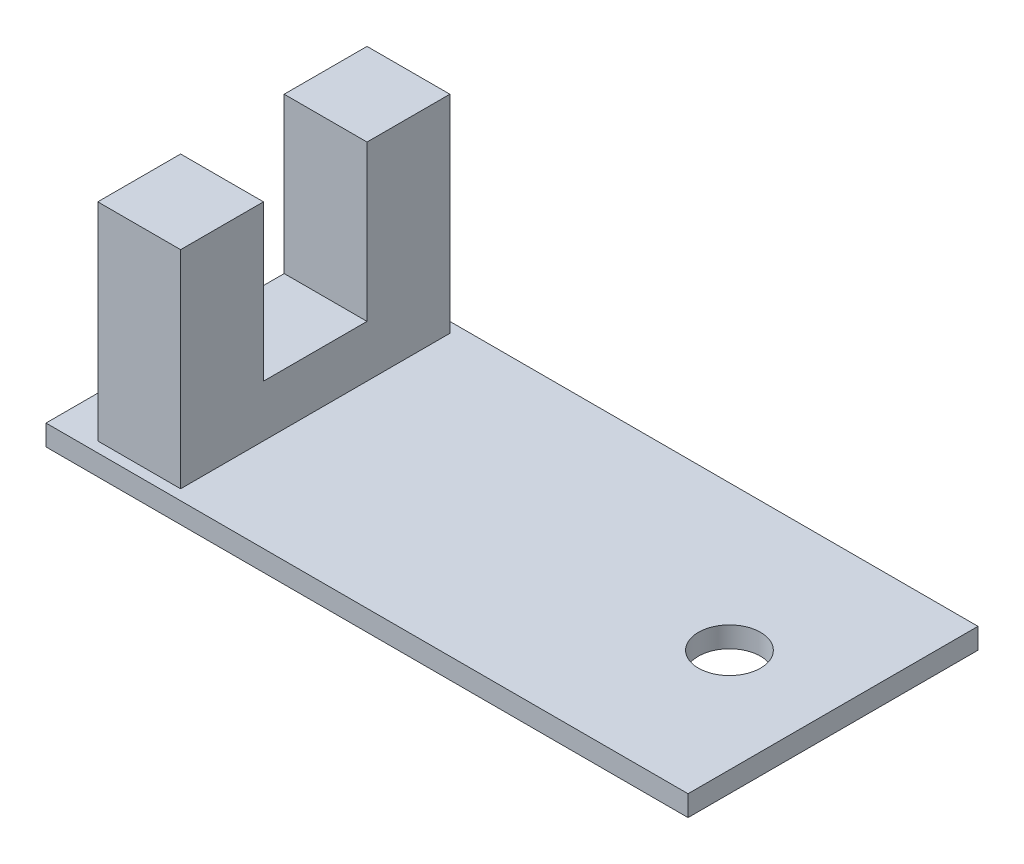
from build123d import *

# Parameters (mm, degrees)
SKETCH1_W           = 31
SKETCH1_H           = 14
BOSS_EXTRUDE1_DEPTH = 1
SKETCH2_W           = 4
SKETCH2_H           = 4
BOSS_EXTRUDE2_DEPTH = 10
SKETCH3_R           = 1.5
CUT_EXTRUDE1_DEPTH  = 36.454195802
SKETCH4_W           = 4
SKETCH4_H           = 5
BOSS_EXTRUDE3_DEPTH = 2.5


with BuildPart() as part:
    # Sketch1 → Boss-Extrude1 (new body)
    with BuildSketch(Plane(origin=(0, 0, 0), x_dir=(1, 0, 0), z_dir=(0, 1, 0))):
        with Locations((15.5, -7)):
            Rectangle(SKETCH1_W, SKETCH1_H)
    extrude(amount=BOSS_EXTRUDE1_DEPTH)

    # Sketch2 → Boss-Extrude2 (add)
    with BuildSketch(Plane(origin=(0, 1, 0), x_dir=(1, 0, 0), z_dir=(0, 1, 0))):
        with Locations((4, -11.5)):
            Rectangle(SKETCH2_W, SKETCH2_H)
        with Locations((4, -2.5)):
            Rectangle(SKETCH2_W, SKETCH2_H)
    extrude(amount=BOSS_EXTRUDE2_DEPTH)

    # Sketch3 → Cut-Extrude1 (cut, through all)
    with BuildSketch(Plane(origin=(0, 1, 0), x_dir=(1, 0, 0), z_dir=(0, 1, 0))):
        with Locations(Location((26, -7, 0), (0, 0, 270))):
            Circle(SKETCH3_R)
    extrude(amount=-CUT_EXTRUDE1_DEPTH, mode=Mode.SUBTRACT)

    # Sketch4 → Boss-Extrude3 (add)
    with BuildSketch(Plane(origin=(0, 1, 0), x_dir=(1, 0, 0), z_dir=(0, 1, 0))):
        with Locations((4, -7)):
            Rectangle(SKETCH4_W, SKETCH4_H)
    extrude(amount=BOSS_EXTRUDE3_DEPTH)


solid = part.part
